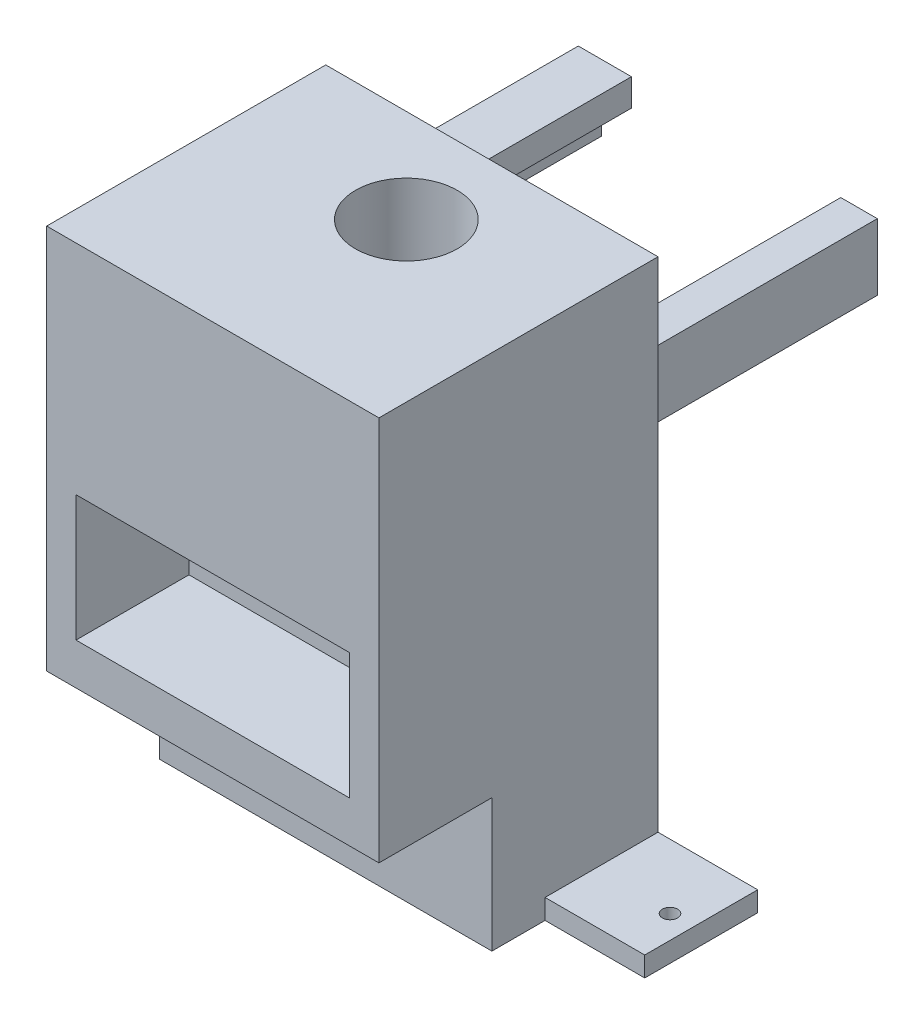
from build123d import *

# Parameters (mm, degrees)
OG_BASE_DEPTH       = 3
SKETCH5_R           = 1.15
CUT_EXTRUDE1_DEPTH  = 3
SKETCH6_W           = 50
SKETCH6_H           = 25
BOSS_EXTRUDE3_DEPTH = 75
SKETCH8_W           = 17
SKETCH8_H           = 58
BOSS_EXTRUDE4_DEPTH = 50
SKETCH10_W          = 45
SKETCH10_H          = 10
BOSS_EXTRUDE5_DEPTH = 35.5
SKETCH11_W          = 40.26
SKETCH11_H          = 1.8
CUT_EXTRUDE2_DEPTH  = 40
SKETCH13_W          = 38
SKETCH13_H          = 4.1
CUT_EXTRUDE3_DEPTH  = 40
SKETCH14_W          = 31.5
SKETCH14_H          = 4.1
CUT_EXTRUDE4_DEPTH  = 40
SKETCH19_R          = 7.65
CUT_EXTRUDE6_DEPTH  = 28
SKETCH21_W          = 41.177647426
SKETCH21_H          = 18.949912373
CUT_EXTRUDE7_DEPTH  = 17


with BuildPart() as part:
    # Sketch3 → OG base (new body)
    with BuildSketch(Plane(origin=(0, 0, 0), x_dir=(1, 0, 0), z_dir=(0, 1, 0))):
        Polygon((-41.21875, 24.460069444), (38.78125, 24.460069444), (38.78125, 7.460069444), (23.78125, 7.460069444), (23.78125, -0.539930556), (-26.21875, -0.539930556), (-26.21875, 7.460069444), (-41.21875, 7.460069444), align=None)
    extrude(amount=OG_BASE_DEPTH)

    # Sketch5 → Cut-Extrude1 (cut)
    with BuildSketch(Plane(origin=(0, 3, 0), x_dir=(1, 0, 0), z_dir=(0, 1, 0))):
        with Locations(Location((-37.71875, 14.760831394, 0), (0, 0, 270))):
            Circle(SKETCH5_R)
        with Locations(Location((35.28125, 14.760831394, 0), (0, 0, 270))):
            Circle(SKETCH5_R)
    extrude(amount=-CUT_EXTRUDE1_DEPTH, mode=Mode.SUBTRACT)

    # Sketch6 → Boss-Extrude3 (add)
    with BuildSketch(Plane(origin=(0, 3, 0), x_dir=(1, 0, 0), z_dir=(0, 1, 0))):
        with Locations((-1.21875, 11.960069444)):
            Rectangle(SKETCH6_W, SKETCH6_H)
    extrude(amount=BOSS_EXTRUDE3_DEPTH)

    # Sketch8 → Boss-Extrude4 (add)
    with BuildSketch(Plane.ZY.offset(26.21875)):
        with Locations((9.039930556, 49)):
            Rectangle(SKETCH8_W, SKETCH8_H)
    extrude(amount=-BOSS_EXTRUDE4_DEPTH)

    # Sketch10 → Boss-Extrude5 (add)
    with BuildSketch(Plane(origin=(0, 0, -24.460069444), x_dir=(-1, 0, 0), z_dir=(0, 0, -1))):
        with Locations((1.21875, 58.965562055)):
            Rectangle(SKETCH10_W, SKETCH10_H)
    extrude(amount=BOSS_EXTRUDE5_DEPTH)

    # Sketch11 → Cut-Extrude2 (cut)
    with BuildSketch(Plane(origin=(0, 0, -59.960069444), x_dir=(-1, 0, 0), z_dir=(0, 0, -1))):
        with Locations((1.21875, 58.965562055)):
            Rectangle(SKETCH11_W, SKETCH11_H)
    extrude(amount=-CUT_EXTRUDE2_DEPTH, mode=Mode.SUBTRACT)

    # Sketch13 → Cut-Extrude3 (cut)
    with BuildSketch(Plane(origin=(0, 0, -59.960069444), x_dir=(-1, 0, 0), z_dir=(0, 0, -1))):
        with Locations((1.21875, 56.015562055)):
            Rectangle(SKETCH13_W, SKETCH13_H)
    extrude(amount=-CUT_EXTRUDE3_DEPTH, mode=Mode.SUBTRACT)

    # Sketch14 → Cut-Extrude4 (cut)
    with BuildSketch(Plane(origin=(0, 0, -59.960069444), x_dir=(-1, 0, 0), z_dir=(0, 0, -1))):
        with Locations((-0.03125, 61.915562055)):
            Rectangle(SKETCH14_W, SKETCH14_H)
    extrude(amount=-CUT_EXTRUDE4_DEPTH, mode=Mode.SUBTRACT)

    # Sketch19 → Cut-Extrude6 (cut)
    with BuildSketch(Plane(origin=(0, 78, 0), x_dir=(1, 0, 0), z_dir=(0, 1, 0))):
        with Locations(Location((0, 10.366835576, 0), (0, 0, 270))):
            Circle(SKETCH19_R)
    extrude(amount=-CUT_EXTRUDE6_DEPTH, mode=Mode.SUBTRACT)

    # Sketch21 → Cut-Extrude7 (cut)
    with BuildSketch(Plane.XY.offset(17.539930556)):
        with Locations((-1.21875, 35.722177319)):
            Rectangle(SKETCH21_W, SKETCH21_H)
    extrude(amount=-CUT_EXTRUDE7_DEPTH, mode=Mode.SUBTRACT)


solid = part.part
